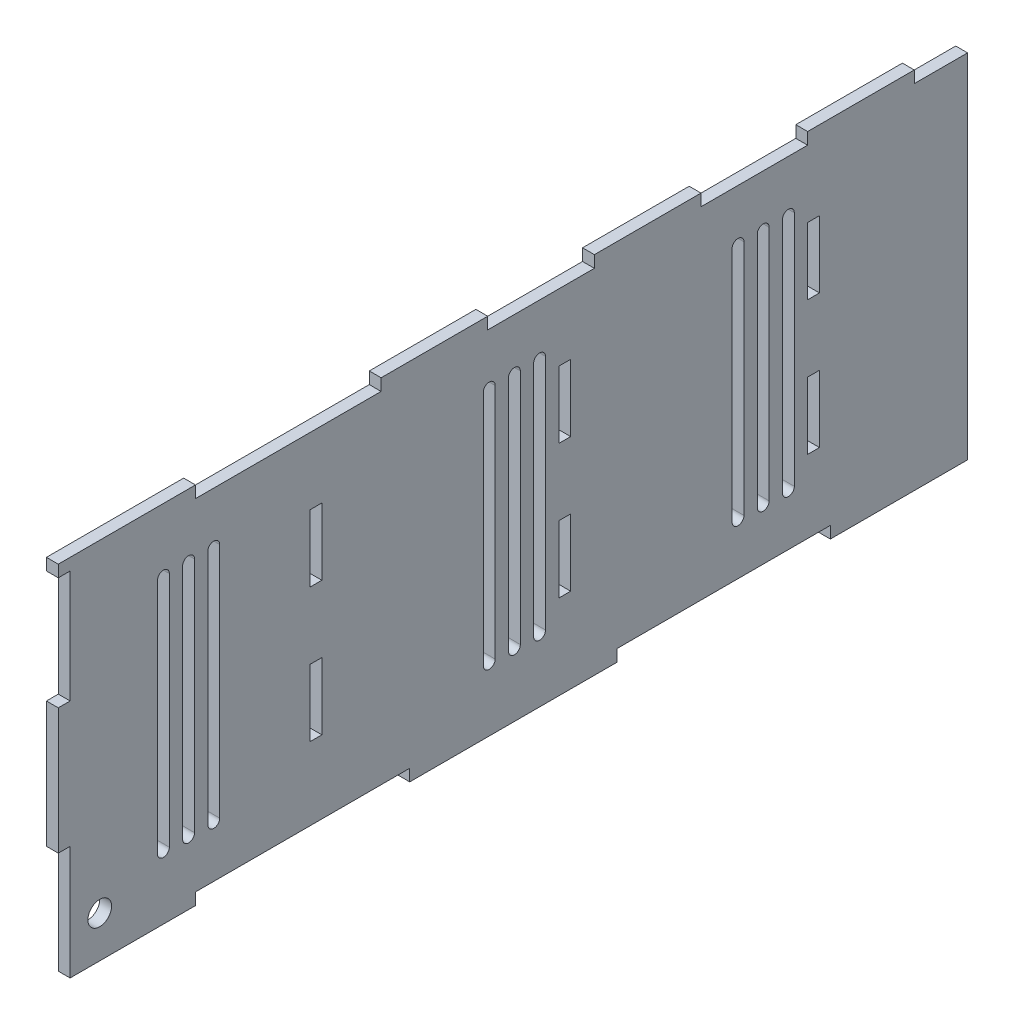
from build123d import *

# Parameters (mm, degrees)
SKETCH1_W           = 307
SKETCH1_H           = 115
BOSS_EXTRUDE1_DEPTH = 4
SKETCH2_W           = 46.333333333
SKETCH2_H           = 4
BOSS_EXTRUDE2_DEPTH = 4
SKETCH3_W           = 4
SKETCH3_H           = 38
SKETCH3_H_2         = 38.5
CUT_EXTRUDE1_DEPTH  = 4
SKETCH4_W           = 4
SKETCH4_H           = 22.6
CUT_EXTRUDE2_DEPTH  = 328.856676003
SKETCH5_R           = 4
CUT_EXTRUDE3_DEPTH  = 4
LPATTERN2_COUNT     = 3
LPATTERN2_PITCH     = 84
SKETCH6_W           = 70
SKETCH6_H           = 4
BOSS_EXTRUDE3_DEPTH = 4
LPATTERN1_COUNT     = 2
LPATTERN1_PITCH     = 119
SKETCH7_W           = 18
SKETCH7_H           = 4
CUT_EXTRUDE4_DEPTH  = 4
SKETCH8_W           = 36
SKETCH8_H           = 4
BOSS_EXTRUDE5_DEPTH = 4
CUT_EXTRUDE5_DEPTH  = 4
LPATTERN3_COUNT     = 3
LPATTERN3_PITCH     = 84
LPATTERN4_COUNT     = 2
LPATTERN4_PITCH     = 110


with BuildPart() as part:
    # Sketch1 → Boss-Extrude1 (new body)
    with BuildSketch(Plane(origin=(0, 0, 0), x_dir=(0, 0, -1), z_dir=(1, 0, 0))):
        with Locations((153.5, 57.5)):
            Rectangle(SKETCH1_W, SKETCH1_H)
    extrude(amount=BOSS_EXTRUDE1_DEPTH)

    # Sketch2 → Boss-Extrude2 (add)
    with BuildSketch(Plane(origin=(4, 0, 0), x_dir=(0, 0, -1), z_dir=(1, 0, 0))):
        with Locations((23.166666667, -2)):
            Rectangle(SKETCH2_W, SKETCH2_H)
        with Locations((283.833333334, -2)):
            Rectangle(SKETCH2_W, SKETCH2_H)
    boss_extrude2 = extrude(amount=-BOSS_EXTRUDE2_DEPTH)

    # Sketch3 → Cut-Extrude1 (cut)
    with BuildSketch(Plane(origin=(4, 0, 0), x_dir=(0, 0, -1), z_dir=(1, 0, 0))):
        with Locations((2, 96)):
            Rectangle(SKETCH3_W, SKETCH3_H)
        with Locations((2, 15.25)):
            Rectangle(SKETCH3_W, SKETCH3_H_2)
    extrude(amount=-CUT_EXTRUDE1_DEPTH, mode=Mode.SUBTRACT)

    # Sketch4 → Cut-Extrude2 (cut, through all)
    with BuildSketch(Plane(origin=(4, 0, 0), x_dir=(0, 0, -1), z_dir=(1, 0, 0))):
        with Locations((255, 81.1)):
            Rectangle(SKETCH4_W, SKETCH4_H)
        with Locations((255, 35.9)):
            Rectangle(SKETCH4_W, SKETCH4_H)
    cut_extrude2 = extrude(amount=-CUT_EXTRUDE2_DEPTH, mode=Mode.SUBTRACT)

    # Sketch5 → Cut-Extrude3 (cut)
    with BuildSketch(Plane(origin=(4, 0, 0), x_dir=(0, 0, -1), z_dir=(1, 0, 0))):
        with Locations((14, 10)):
            Circle(SKETCH5_R)
    extrude(amount=-CUT_EXTRUDE3_DEPTH, mode=Mode.SUBTRACT)

    # LPattern2: Cut-Extrude2 ×3
    with Locations(*[(0, 0, i * LPATTERN2_PITCH) for i in range(1, LPATTERN2_COUNT)]):
        add(cut_extrude2, mode=Mode.SUBTRACT)

    # Sketch6 → Boss-Extrude3 (add)
    with BuildSketch(Plane.ZY):
        with Locations((-153.666666667, -2)):
            Rectangle(SKETCH6_W, SKETCH6_H)
    extrude(amount=-BOSS_EXTRUDE3_DEPTH)

    # LPattern1: Boss-Extrude2 ×2
    with Locations(*[(0, i * LPATTERN1_PITCH, 0) for i in range(1, LPATTERN1_COUNT)]):
        add(boss_extrude2)

    # Sketch7 → Cut-Extrude4 (cut)
    with BuildSketch(Plane(origin=(4, 0, 0), x_dir=(0, 0, -1), z_dir=(1, 0, 0))):
        with Locations((298, 117)):
            Rectangle(SKETCH7_W, SKETCH7_H)
    extrude(amount=-CUT_EXTRUDE4_DEPTH, mode=Mode.SUBTRACT)

    # Sketch8 → Boss-Extrude5 (add)
    with BuildSketch(Plane(origin=(4, 0, 0), x_dir=(0, 0, -1), z_dir=(1, 0, 0))):
        with Locations((271, 117)):
            Rectangle(SKETCH8_W, SKETCH8_H)
        with Locations((199, 117)):
            Rectangle(SKETCH8_W, SKETCH8_H)
        with Locations((127, 117)):
            Rectangle(SKETCH8_W, SKETCH8_H)
    extrude(amount=-BOSS_EXTRUDE5_DEPTH)

    # Sketch9 → Cut-Extrude5 (cut)
    with BuildSketch(Plane(origin=(4, 0, 0), x_dir=(0, 0, -1), z_dir=(1, 0, 0))):
        with BuildLine():
            Line((164.5, 97.5), (164.5, 17.5))
            ThreePointArc((164.5, 17.5), (162.5, 15.5), (160.5, 17.5))
            Line((160.5, 17.5), (160.5, 97.5))
            ThreePointArc((160.5, 97.5), (162.5, 99.5), (164.5, 97.5))
        make_face()
        with BuildLine():
            Line((152, 97.5), (152, 17.5))
            ThreePointArc((152, 17.5), (154, 15.5), (156, 17.5))
            Line((156, 17.5), (156, 97.5))
            ThreePointArc((156, 97.5), (154, 99.5), (152, 97.5))
        make_face()
        with BuildLine():
            Line((143.5, 97.5), (143.5, 17.5))
            ThreePointArc((143.5, 17.5), (145.5, 15.5), (147.5, 17.5))
            Line((147.5, 17.5), (147.5, 97.5))
            ThreePointArc((147.5, 97.5), (145.5, 99.5), (143.5, 97.5))
        make_face()
    cut_extrude5 = extrude(amount=-CUT_EXTRUDE5_DEPTH, mode=Mode.SUBTRACT)

    # LPattern3: Cut-Extrude5 ×3
    with Locations(*[(0, 0, -i * LPATTERN3_PITCH) for i in range(1, LPATTERN3_COUNT)]):
        add(cut_extrude5, mode=Mode.SUBTRACT)

    # LPattern4: Cut-Extrude5 ×2
    with Locations(*[(0, 0, i * LPATTERN4_PITCH) for i in range(1, LPATTERN4_COUNT)]):
        add(cut_extrude5, mode=Mode.SUBTRACT)


solid = part.part
